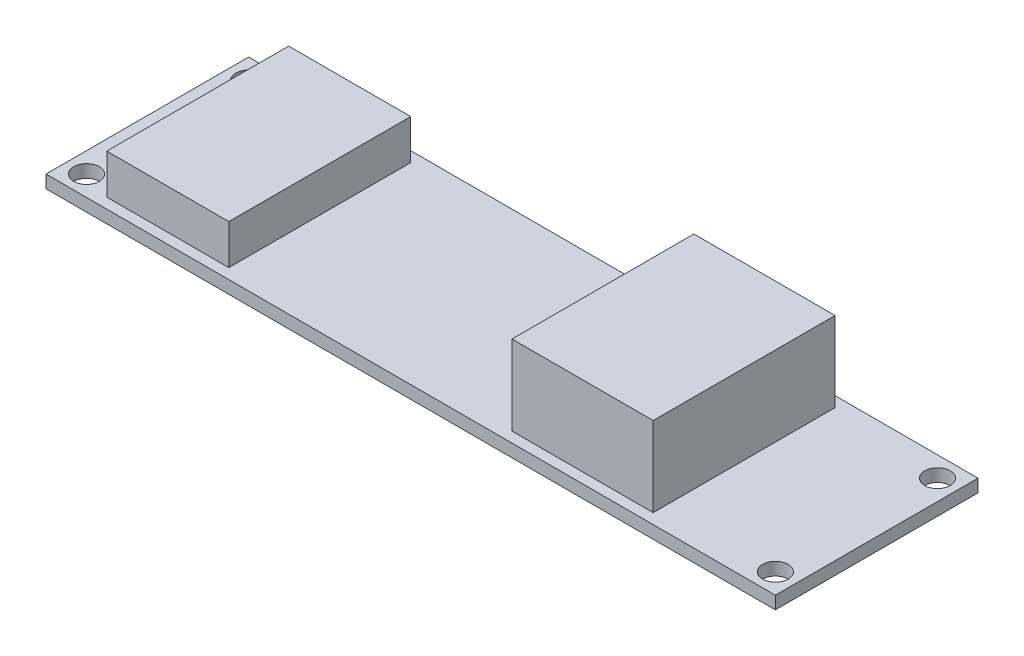
from build123d import *

# Parameters (mm, degrees)
SKETCH_1_W      = 91.44
SKETCH_1_H      = 25.4
SKETCH_1_R      = 1.6
EXTRUDE_1_DEPTH = 1.6
SKETCH_2_W      = 15.3
SKETCH_2_H      = 22.8
EXTRUDE_2_DEPTH = 5
SKETCH_3_W      = 17.7
SKETCH_3_H      = 22.8
EXTRUDE_3_DEPTH = 10


with BuildPart() as part:
    # 草图1 → 凸台-拉伸1 (new body)
    with BuildSketch(Plane(origin=(0, 0, 0), x_dir=(1, 0, 0), z_dir=(0, 1, 0))):
        Rectangle(SKETCH_1_W, SKETCH_1_H)
        with Locations(Location((-43.18, 10.16, 0), (0, 0, 270))):
            Circle(SKETCH_1_R, mode=Mode.SUBTRACT)
        with Locations(Location((43.18, 10.16, 0), (0, 0, 90))):
            Circle(SKETCH_1_R, mode=Mode.SUBTRACT)
        with Locations(Location((43.18, -10.16, 0), (0, 0, 270))):
            Circle(SKETCH_1_R, mode=Mode.SUBTRACT)
        with Locations(Location((-43.18, -10.16, 0), (0, 0, 90))):
            Circle(SKETCH_1_R, mode=Mode.SUBTRACT)
    extrude(amount=EXTRUDE_1_DEPTH)

    # 草图2 → 凸台-拉伸2 (add)
    with BuildSketch(Plane(origin=(0, 1.6, 0), x_dir=(1, 0, 0), z_dir=(0, 1, 0))):
        with Locations((-31.75, 0)):
            Rectangle(SKETCH_2_W, SKETCH_2_H)
    extrude(amount=EXTRUDE_2_DEPTH)

    # 草图3 → 凸台-拉伸3 (add)
    with BuildSketch(Plane(origin=(0, 1.6, 0), x_dir=(1, 0, 0), z_dir=(0, 1, 0))):
        with Locations((20.25, 0)):
            Rectangle(SKETCH_3_W, SKETCH_3_H)
    extrude(amount=EXTRUDE_3_DEPTH)


solid = part.part
